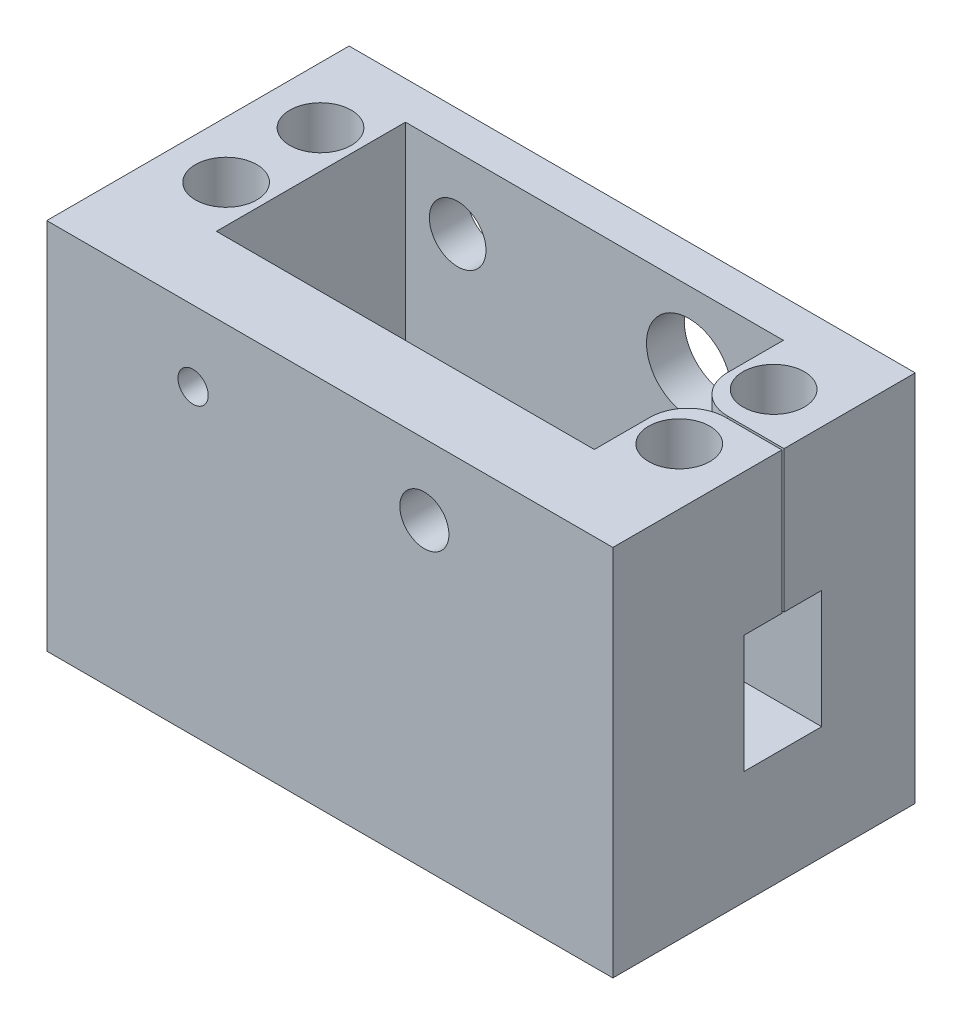
from build123d import *

# Parameters (mm, degrees)
SKETCH1_R           = 3.25
SKETCH1_W           = 55.97
SKETCH1_H           = 4
SKETCH1_W_2         = 2
BOSS_EXTRUDE1_DEPTH = 7.5
SKETCH2_R           = 3.25
BOSS_EXTRUDE2_DEPTH = 5
SKETCH3_R           = 1.6
SKETCH3_R_2         = 2.6
CUT_EXTRUDE1_DEPTH  = 10
SKETCH4_R           = 3
SKETCH4_R_2         = 4.5
CUT_EXTRUDE2_DEPTH  = 28.03
BOSS_EXTRUDE3_DEPTH = 12.5
SKETCH6_W           = 59.97
SKETCH6_H           = 32.03
BOSS_EXTRUDE4_DEPTH = 12


with BuildPart() as part:
    # Sketch1 → Boss-Extrude1 (new, symmetric)
    # profile 1 of 8: a face of its own
    with BuildSketch(Plane(origin=(0, 0, 0), x_dir=(1, 0, 0), z_dir=(0, 1, 0))):
        with BuildLine():
            ThreePointArc((24, -0.115), (21.182179477, -1.282179477), (20.015, -4.1))
            Line((20.015, -4.1), (20.015, -10.015))
            Line((20.015, -10.015), (-20.015, -10.015))
            Line((-20.015, -10.015), (-20.015, 10.015))
            Line((-20.015, 10.015), (20.015, 10.015))
            Line((20.015, 10.015), (20.015, 4.1))
            ThreePointArc((20.015, 4.1), (21.182179477, 1.282179477), (24, 0.115))
            ThreePointArc((24, 0.115), (26.817820523, 1.282179477), (27.985, 4.1))
            Line((27.985, 4.1), (27.985, 14.015))
            Line((27.985, 14.015), (-27.985, 14.015))
            Line((-27.985, 14.015), (-27.985, -14.015))
            Line((-27.985, -14.015), (27.985, -14.015))
            Line((27.985, -14.015), (27.985, -4.1))
            ThreePointArc((27.985, -4.1), (26.817820523, -1.282179477), (24, -0.115))
        make_face()
        with Locations(Location((-24, -5, 0), (0, 0, 270))):
            Circle(SKETCH1_R, mode=Mode.SUBTRACT)
        with Locations(Location((24, -5, 0), (0, 0, 270))):
            Circle(SKETCH1_R, mode=Mode.SUBTRACT)
        with Locations(Location((-24, 5, 0), (0, 0, 270))):
            Circle(SKETCH1_R, mode=Mode.SUBTRACT)
        with Locations(Location((24, 5, 0), (0, 0, 270))):
            Circle(SKETCH1_R, mode=Mode.SUBTRACT)
    # profile 2 of 8: a face of its own
    with BuildSketch(Plane(origin=(0, 0, 0), x_dir=(1, 0, 0), z_dir=(0, 1, 0))):
        with Locations((0, -16.015)):
            Rectangle(SKETCH1_W, SKETCH1_H)
    # profile 3 of 8: a face of its own
    with BuildSketch(Plane(origin=(0, 0, 0), x_dir=(1, 0, 0), z_dir=(0, 1, 0))):
        Polygon((27.985, 4.1), (27.985, 0.115), (29.985, 0.115), (29.985, 14.015), (27.985, 14.015), align=None)
    # profile 4 of 8: a face of its own
    with BuildSketch(Plane(origin=(0, 0, 0), x_dir=(1, 0, 0), z_dir=(0, 1, 0))):
        Polygon((29.985, -0.115), (27.985, -0.115), (27.985, -4.1), (27.985, -14.015), (29.985, -14.015), align=None)
    # profile 5 of 8: a face of its own
    with BuildSketch(Plane(origin=(0, 0, 0), x_dir=(1, 0, 0), z_dir=(0, 1, 0))):
        with BuildLine():
            Line((27.985, -4.1), (27.985, -0.115))
            Line((27.985, -0.115), (24, -0.115))
            ThreePointArc((24, -0.115), (26.817820523, -1.282179477), (27.985, -4.1))
        make_face()
    # profile 6 of 8: a face of its own
    with BuildSketch(Plane(origin=(0, 0, 0), x_dir=(1, 0, 0), z_dir=(0, 1, 0))):
        with BuildLine():
            Line((24, 0.115), (27.985, 0.115))
            Line((27.985, 0.115), (27.985, 4.1))
            ThreePointArc((27.985, 4.1), (26.817820523, 1.282179477), (24, 0.115))
        make_face()
    # profile 7 of 8: a face of its own
    with BuildSketch(Plane(origin=(0, 0, 0), x_dir=(1, 0, 0), z_dir=(0, 1, 0))):
        with Locations((28.985, -16.015)):
            Rectangle(SKETCH1_W_2, SKETCH1_H)
    # profile 8 of 8: a face of its own
    with BuildSketch(Plane(origin=(0, 0, 0), x_dir=(1, 0, 0), z_dir=(0, 1, 0))):
        Polygon((-29.985, 14.015), (-29.985, -18.015), (-27.985, -18.015), (-27.985, -14.015), (-27.985, 14.015), align=None)
    extrude(amount=BOSS_EXTRUDE1_DEPTH, both=True)

    # Sketch2 → Boss-Extrude2 (add)
    with BuildSketch(Plane.XZ.offset(7.5)):
        with Locations(Location((24, -5, 0), (0, 0, 90))):
            Circle(SKETCH2_R)
        with Locations(Location((24, 5, 0), (0, 0, 90))):
            Circle(SKETCH2_R)
        with Locations(Location((-24, -5, 0), (0, 0, 90))):
            Circle(SKETCH2_R)
        with Locations(Location((-24, 5, 0), (0, 0, 90))):
            Circle(SKETCH2_R)
    extrude(amount=-BOSS_EXTRUDE2_DEPTH)

    # Sketch3 → Cut-Extrude1 (cut)
    with BuildSketch(Plane.XY.offset(18.015)):
        with Locations((-14.485, 0)):
            Circle(SKETCH3_R)
        with Locations((10.015, 0)):
            Circle(SKETCH3_R_2)
    extrude(amount=-CUT_EXTRUDE1_DEPTH, mode=Mode.SUBTRACT)

    # Sketch4 → Cut-Extrude2 (cut)
    with BuildSketch(Plane(origin=(0, 0, -14.015), x_dir=(-1, 0, 0), z_dir=(0, 0, -1))):
        with Locations((14.485, 0)):
            Circle(SKETCH4_R)
        with Locations((-10.015, 0)):
            Circle(SKETCH4_R_2)
    extrude(amount=-CUT_EXTRUDE2_DEPTH, mode=Mode.SUBTRACT)

    # Sketch5 → Boss-Extrude3 (add)
    with BuildSketch(Plane.XZ.offset(7.5)):
        Polygon((29.985, -4.1), (20.015, -4.1), (20.015, -10.015), (-20.015, -10.015), (-20.015, 10.015), (20.015, 10.015), (20.015, 4.1), (29.985, 4.1), (29.985, 18.015), (-29.985, 18.015), (-29.985, -14.015), (29.985, -14.015), align=None)
    extrude(amount=BOSS_EXTRUDE3_DEPTH)

    # Sketch6 → Boss-Extrude4 (add)
    with BuildSketch(Plane.XZ.offset(20)):
        with Locations((0, 2)):
            Rectangle(SKETCH6_W, SKETCH6_H)
    extrude(amount=BOSS_EXTRUDE4_DEPTH)


solid = part.part
